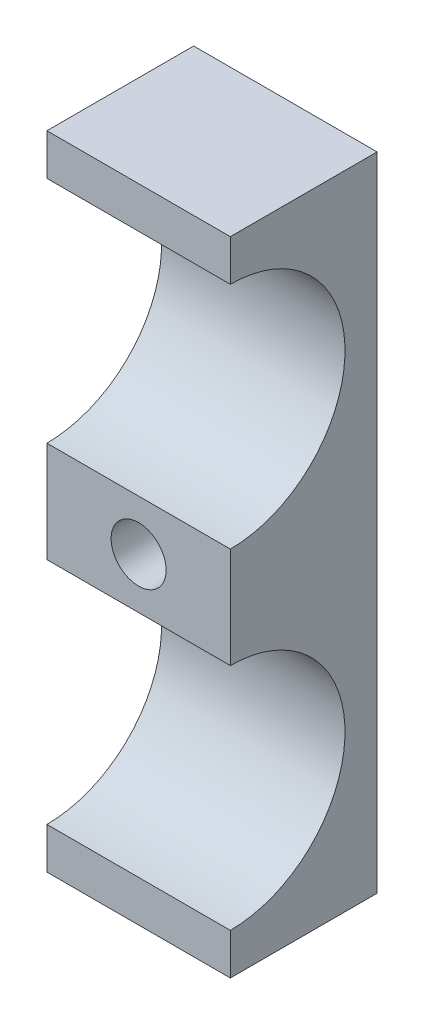
from build123d import *

# Parameters (mm, degrees)
SZKIC1_W                    = 20
SZKIC1_H                    = 70
DODANIE_WYCI_GNI_CIE1_DEPTH = 16
SZKIC2_R                    = 12.5
WYTNIJ_WYCI_GNI_CIE1_DEPTH  = 44.370496884
SZKIC3_R                    = 3
WYTNIJ_WYCI_GNI_CIE2_DEPTH  = 40.761790704


with BuildPart() as part:
    # Szkic1 → Dodanie-wyciągnięcie1 (new body)
    with BuildSketch(Plane.XY):
        Rectangle(SZKIC1_W, SZKIC1_H)
    extrude(amount=DODANIE_WYCI_GNI_CIE1_DEPTH)

    # Szkic2 → Wytnij-wyciągnięcie1 (cut, through all)
    with BuildSketch(Plane.ZY.offset(10)):
        with Locations((16, 18)):
            Circle(SZKIC2_R)
        with Locations((16, -18)):
            Circle(SZKIC2_R)
    extrude(amount=-WYTNIJ_WYCI_GNI_CIE1_DEPTH, mode=Mode.SUBTRACT)

    # Szkic3 → Wytnij-wyciągnięcie2 (cut, through all)
    with BuildSketch(Plane.XY.offset(16)):
        Circle(SZKIC3_R)
    extrude(amount=-WYTNIJ_WYCI_GNI_CIE2_DEPTH, mode=Mode.SUBTRACT)


solid = part.part
